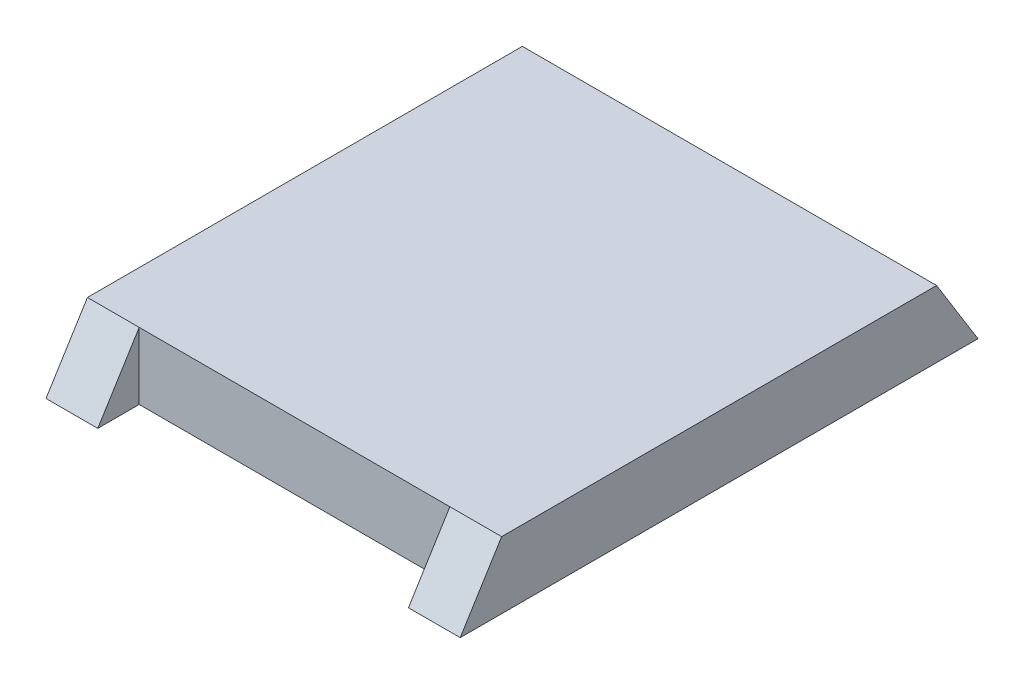
from build123d import *

# Parameters (mm, degrees)
SKETCH1_W           = 800
SKETCH1_H           = 1000
BOSS_EXTRUDE1_DEPTH = 129
CUT_EXTRUDE1_DEPTH  = 800
SKETCH17_W          = 600
SKETCH17_H          = 151.792621691
CUT_EXTRUDE2_DEPTH  = 275
SKETCH25_W          = 600
SKETCH25_H          = 129
CUT_EXTRUDE4_DEPTH  = 80
CUT_EXTRUDE5_DEPTH  = 100
CUT_EXTRUDE6_DEPTH  = 100
BOSS_EXTRUDE4_DEPTH = 600


with BuildPart() as part:
    # Sketch1 → Boss-Extrude1 (new body)
    with BuildSketch(Plane(origin=(0, 0, 0), x_dir=(1, 0, 0), z_dir=(0, 1, 0))):
        Rectangle(SKETCH1_W, SKETCH1_H)
    extrude(amount=BOSS_EXTRUDE1_DEPTH)

    # Sketch2 → Cut-Extrude1 (cut)
    with BuildSketch(Plane.ZY.offset(400)):
        Polygon((420, 129), (500, 0), (500, 129), align=None)
    extrude(amount=-CUT_EXTRUDE1_DEPTH, mode=Mode.SUBTRACT)

    # Sketch17 → Cut-Extrude2 (cut)
    with BuildSketch(Plane(origin=(0, 223.948613341, 361.117139013), x_dir=(1, 0, 0), z_dir=(0, 0.5270348394308224, 0.849843678582201))):
        with Locations((0, -187.62110887)):
            Rectangle(SKETCH17_W, SKETCH17_H)
    extrude(amount=-CUT_EXTRUDE2_DEPTH, mode=Mode.SUBTRACT)

    # Sketch25 → Cut-Extrude4 (cut)
    with BuildSketch(Plane(origin=(0, 0, -500), x_dir=(-1, 0, 0), z_dir=(0, 0, -1))):
        with Locations((0, 64.5)):
            Rectangle(SKETCH25_W, SKETCH25_H)
    extrude(amount=-CUT_EXTRUDE4_DEPTH, mode=Mode.SUBTRACT)

    # Sketch28 → Cut-Extrude5 (cut)
    with BuildSketch(Plane(origin=(-300, 0, 0), x_dir=(0, 0, -1), z_dir=(1, 0, 0))):
        Polygon((420, 129), (500, 129), (500, 0), align=None)
    extrude(amount=-CUT_EXTRUDE5_DEPTH, mode=Mode.SUBTRACT)

    # Sketch29 → Cut-Extrude6 (cut)
    with BuildSketch(Plane.ZY.offset(-300)):
        Polygon((-420, 129), (-500, 129), (-500, 0), align=None)
    extrude(amount=-CUT_EXTRUDE6_DEPTH, mode=Mode.SUBTRACT)

    # Sketch31 → Boss-Extrude4 (add)
    with BuildSketch(Plane.ZY.offset(-300)):
        Polygon((420, 129), (420, 0), (211.9875, 0), align=None)
    extrude(amount=BOSS_EXTRUDE4_DEPTH)


solid = part.part
